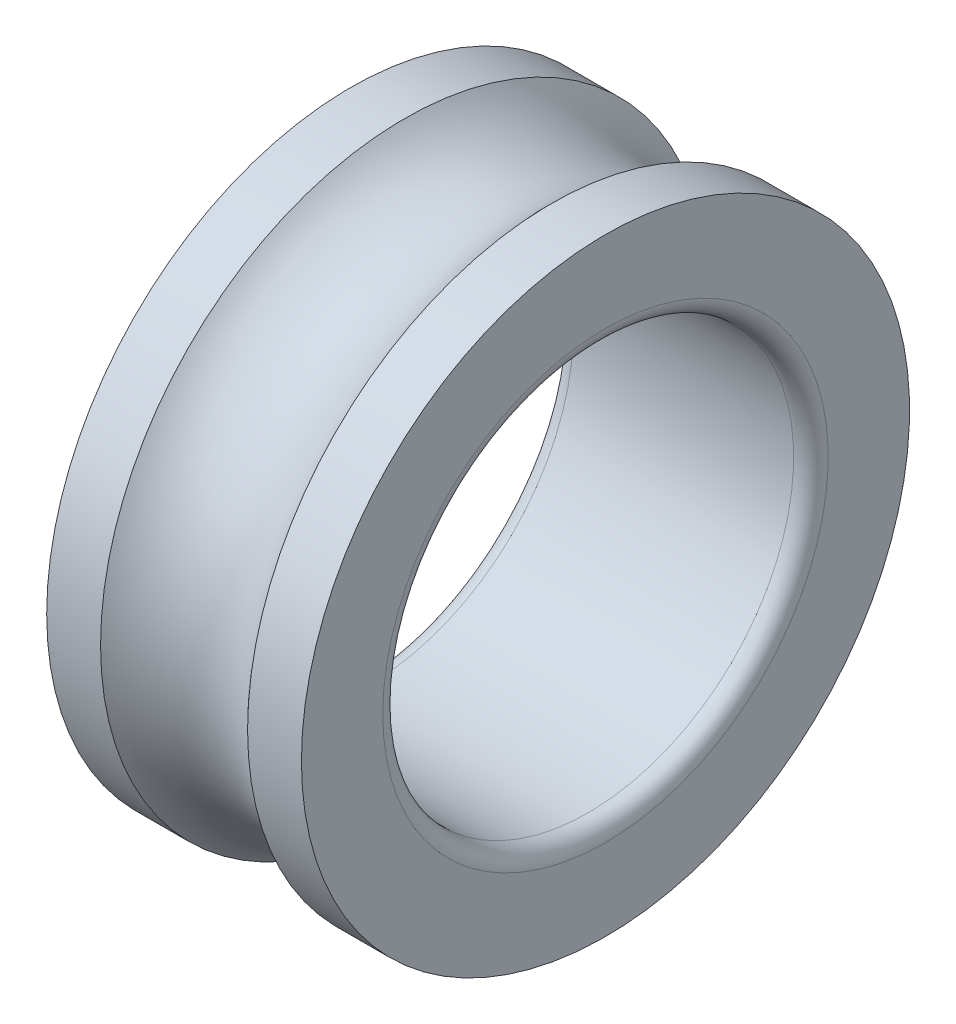
from build123d import *


with BuildPart() as part:
    # Esquisse1 → Révolution1 (revolve)
    with BuildSketch(Plane.XY, mode=Mode.PRIVATE) as r_volution1_sk:
        with BuildLine():
            Line((-13.4, 25), (13.4, 25))
            ThreePointArc((13.4, 25), (14.88492424, 25.61507576), (15.5, 27.1))
            Line((15.5, 27.1), (15.5, 37))
            Line((15.5, 37), (8.94427191, 37))
            ThreePointArc((8.94427191, 37), (0, 33), (-8.94427191, 37))
            Line((-8.94427191, 37), (-15.5, 37))
            Line((-15.5, 37), (-15.5, 27.1))
            ThreePointArc((-15.5, 27.1), (-14.88492424, 25.61507576), (-13.4, 25))
        make_face()
    revolve(r_volution1_sk.sketch.rotate(Axis((-31.072391088, 0, 0), (1, 0, 0)), 90), axis=Axis((-31.072391088, 0, 0), (1, 0, 0)))


solid = part.part
